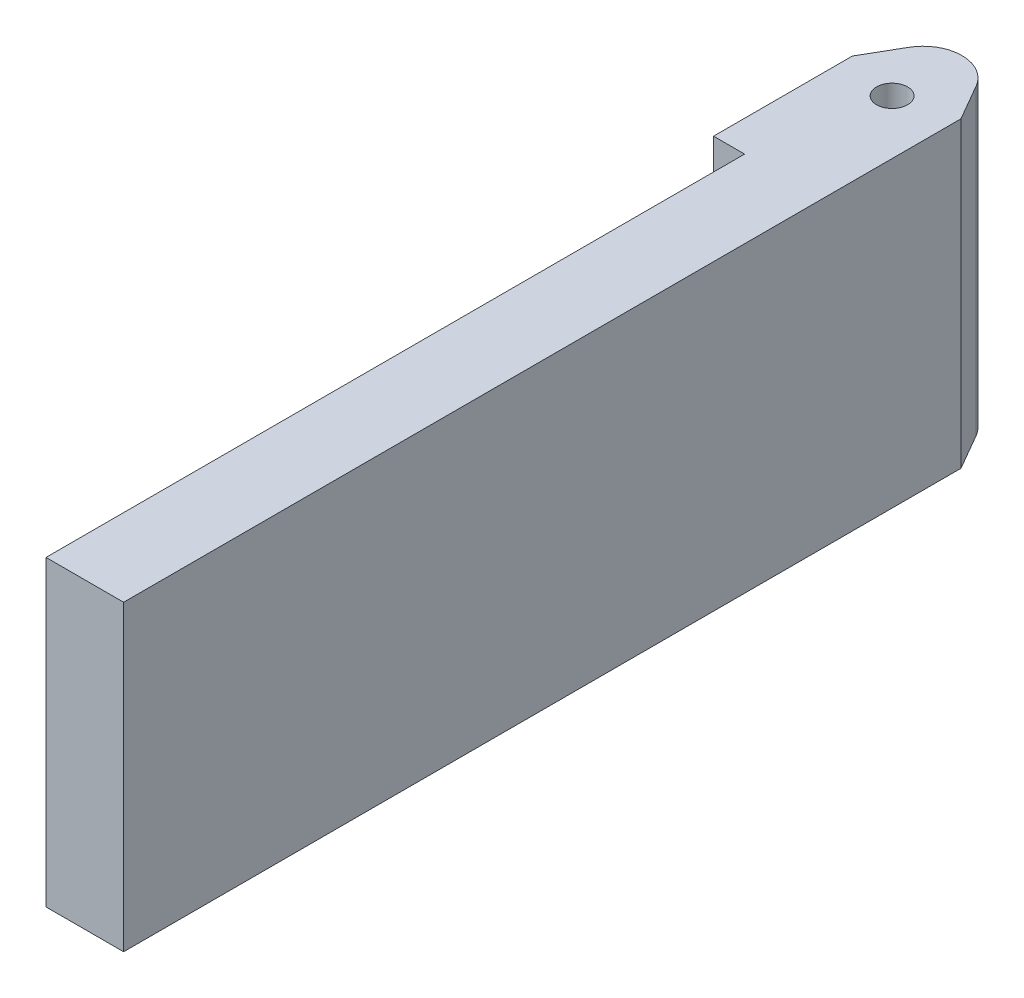
from build123d import *

# Parameters (mm, degrees)
SKETCH1_W           = 30
SKETCH1_H           = 120
BOSS_EXTRUDE1_DEPTH = 39
SKETCH2_OUTSIDE_W   = 57.94
SKETCH2_OUTSIDE_H   = 147.94
CUT_EXTRUDE2_DEPTH  = 74.116345642
FILLET1_R           = 5
CUT_EXTRUDE3_DEPTH  = 74.116345642
SKETCH4_W           = 4
SKETCH4_H           = 90
CUT_EXTRUDE4_DEPTH  = 72.902712049
SKETCH5_R           = 2
CUT_EXTRUDE5_DEPTH  = 72.902712049


with BuildPart() as part:
    # Sketch1 → Boss-Extrude1 (new body)
    with BuildSketch(Plane(origin=(0, 0, 0), x_dir=(1, 0, 0), z_dir=(0, 1, 0))):
        Rectangle(SKETCH1_W, SKETCH1_H)
    extrude(amount=BOSS_EXTRUDE1_DEPTH)

    # Sketch2 outside → Cut-Extrude2 (cut, through all)
    with BuildSketch(Plane(origin=(0, 39, 0), x_dir=(1, 0, 0), z_dir=(0, 1, 0))):
        Rectangle(SKETCH2_OUTSIDE_W, SKETCH2_OUTSIDE_H)
        Polygon((0, 60), (-15, 34.019237886), (-15, -60), (15, -60), (15, 34.019237886), align=None, mode=Mode.SUBTRACT)
    extrude(amount=-CUT_EXTRUDE2_DEPTH, mode=Mode.SUBTRACT)

    # Fillet1
    fillet1_edges = [part.edges().sort_by_distance(p)[0] for p in [
        (0, 19.5, -60),
    ]]
    fillet(fillet1_edges, radius=FILLET1_R)

    # Sketch3 → Cut-Extrude3 (cut, through all)
    with BuildSketch(Plane(origin=(0, 39, 0), x_dir=(1, 0, 0), z_dir=(0, 1, 0))):
        Polygon((-15, 34.019237886), (-15, -60), (-7, -60), (-7, 47.875644347), align=None)
        Polygon((7, 47.875644347), (7, -60), (15, -60), (15, 34.019237886), align=None)
    extrude(amount=-CUT_EXTRUDE3_DEPTH, mode=Mode.SUBTRACT)

    # Sketch4 → Cut-Extrude4 (cut, through all)
    with BuildSketch(Plane(origin=(0, 39, 0), x_dir=(1, 0, 0), z_dir=(0, 1, 0))):
        with Locations((-5, -15)):
            Rectangle(SKETCH4_W, SKETCH4_H)
    extrude(amount=-CUT_EXTRUDE4_DEPTH, mode=Mode.SUBTRACT)

    # Sketch5 → Cut-Extrude5 (cut, through all)
    with BuildSketch(Plane(origin=(0, 39, 0), x_dir=(1, 0, 0), z_dir=(0, 1, 0))):
        with Locations(Location((0, 46, 0), (0, 0, 270))):
            Circle(SKETCH5_R)
    extrude(amount=-CUT_EXTRUDE5_DEPTH, mode=Mode.SUBTRACT)


solid = part.part
